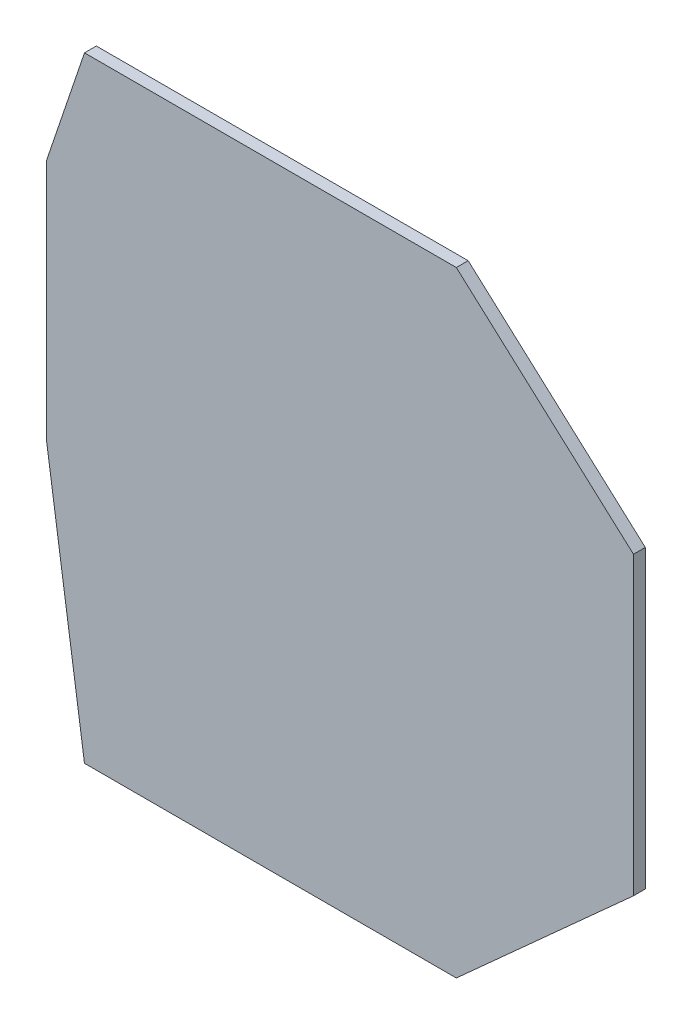
from build123d import *

# Parameters (mm, degrees)
EXTRUDE_1_DEPTH = 3.2


with BuildPart() as part:
    # Эскиз2 → Бобышка-Вытянуть1 (new body)
    with BuildSketch(Plane.XY):
        Polygon((-49.772715521, 143.2), (50.786806886, 143.2), (98.698082302, 100), (98.698082302, 20), (50.786806886, -23.2), (-49.772715521, -23.2), (-60, 47.015966792), (-60, 112.984033208), align=None)
    extrude(amount=EXTRUDE_1_DEPTH)


solid = part.part
